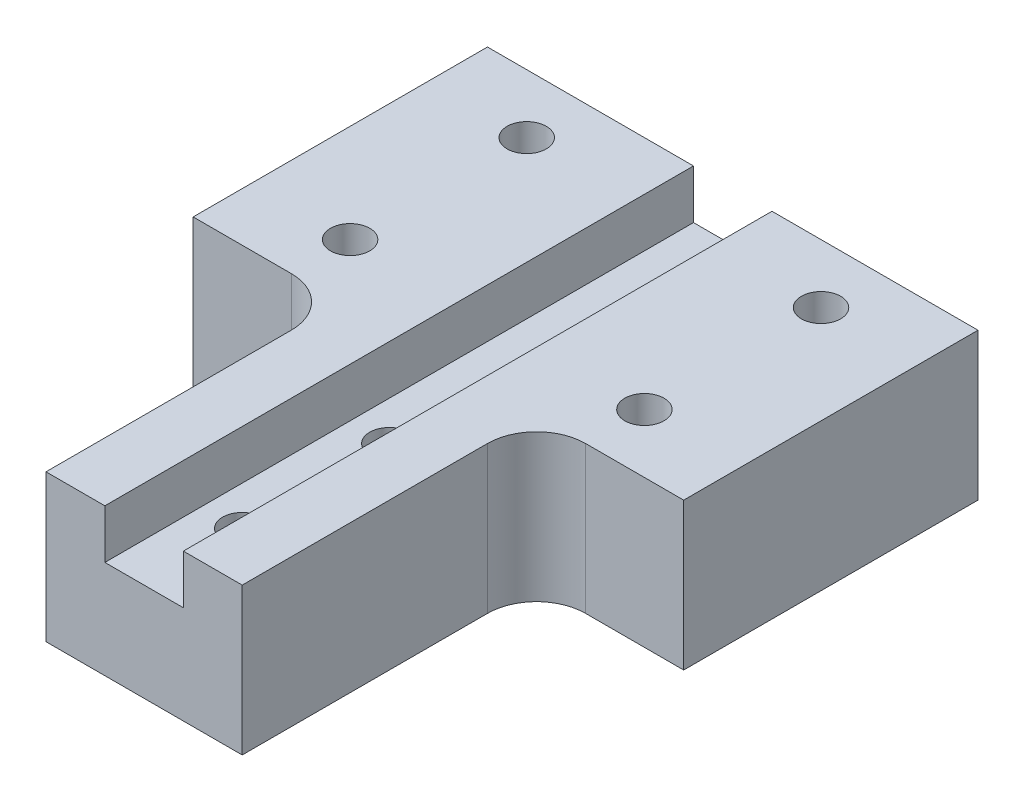
from build123d import *

# Parameters (mm, degrees)
SKETCH1_W           = 50
SKETCH1_H           = 30
SKETCH1_R           = 2
BOSS_EXTRUDE2_DEPTH = 15
SKETCH1_3_W         = 20
SKETCH1_3_H         = 30
SKETCH1_3_R         = 2
BOSS_EXTRUDE3_DEPTH = 15
FILLET1_R           = 5
SKETCH5_W           = 8
SKETCH5_H           = 70
CUT_EXTRUDE1_DEPTH  = 5


with BuildPart() as part:
    # Sketch1 → Boss-Extrude2 (new body)
    with BuildSketch(Plane(origin=(0, 0, 0), x_dir=(1, 0, 0), z_dir=(0, 1, 0))):
        Rectangle(SKETCH1_W, SKETCH1_H)
        with Locations(Location((-15, 9, 0), (0, 0, 270))):
            Circle(SKETCH1_R, mode=Mode.SUBTRACT)
        with Locations(Location((15, 9, 0), (0, 0, 270))):
            Circle(SKETCH1_R, mode=Mode.SUBTRACT)
        with Locations(Location((15, -9, 0), (0, 0, 270))):
            Circle(SKETCH1_R, mode=Mode.SUBTRACT)
        with Locations(Location((-15, -9, 0), (0, 0, 270))):
            Circle(SKETCH1_R, mode=Mode.SUBTRACT)
    extrude(amount=-BOSS_EXTRUDE2_DEPTH)

    # Sketch1<3> → Boss-Extrude3 (add)
    with BuildSketch(Plane(origin=(0, 0, 0), x_dir=(1, 0, 0), z_dir=(0, 1, 0))):
        with Locations((0, -30)):
            Rectangle(SKETCH1_3_W, SKETCH1_3_H)
        with Locations(Location((0, -35, 0), (0, 0, 270))):
            Circle(SKETCH1_3_R, mode=Mode.SUBTRACT)
        with Locations(Location((0, -20, 0), (0, 0, 270))):
            Circle(SKETCH1_3_R, mode=Mode.SUBTRACT)
    extrude(amount=-BOSS_EXTRUDE3_DEPTH)

    # Fillet1
    fillet1_edges = [part.edges().sort_by_distance(p)[0] for p in [
        (-10, -7.5, 15),
        (10, -7.5, 15),
    ]]
    fillet(fillet1_edges, radius=FILLET1_R)

    # Sketch5 → Cut-Extrude1 (cut)
    with BuildSketch(Plane(origin=(0, 0, 0), x_dir=(1, 0, 0), z_dir=(0, 1, 0))):
        with Locations((0, -13.137566138)):
            Rectangle(SKETCH5_W, SKETCH5_H)
    extrude(amount=-CUT_EXTRUDE1_DEPTH, mode=Mode.SUBTRACT)


solid = part.part
